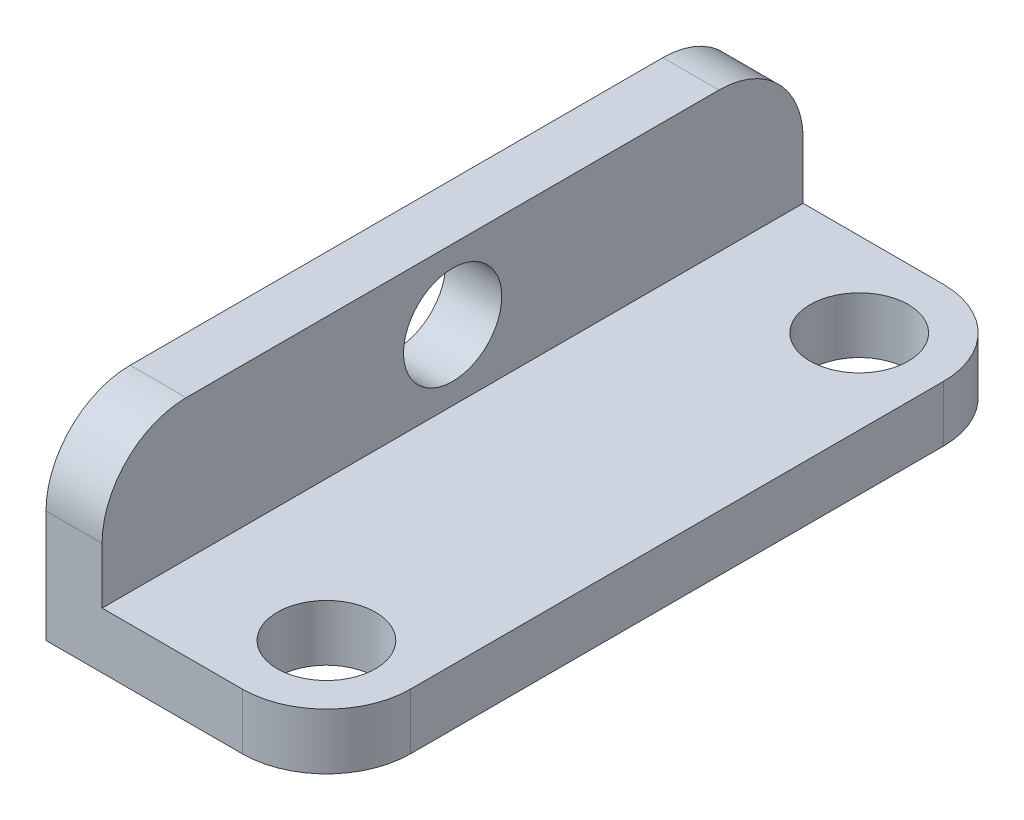
from build123d import *

# Parameters (mm, degrees)
BOSS_EXTRUDE1_DEPTH = 12.5
FILLET1_R           = 3
SKETCH2_R           = 1.75
CUT_EXTRUDE1_DEPTH  = 15.361406616
SKETCH3_R           = 1.75
CUT_EXTRUDE2_DEPTH  = 17.007810594


with BuildPart() as part:
    # Sketch1 → Boss-Extrude1 (new, symmetric)
    with BuildSketch(Plane.XY):
        Polygon((-3, 1), (5, 1), (5, -1), (-5, -1), (-5, 1), (-5, 6), (-3, 6), align=None)
    extrude(amount=BOSS_EXTRUDE1_DEPTH, both=True)

    # Fillet1
    fillet1_edges = [part.edges().sort_by_distance(p)[0] for p in [
        (5, 0, -12.5),
        (-4, 6, 12.5),
        (5, 0, 12.5),
        (-4, 6, -12.5),
    ]]
    fillet(fillet1_edges, radius=FILLET1_R)

    # Sketch2 → Cut-Extrude1 (cut, through all)
    with BuildSketch(Plane(origin=(0, 1, 0), x_dir=(1, 0, 0), z_dir=(0, 1, 0))):
        with Locations(Location((2, -9.5, 0), (0, 0, 270))):
            Circle(SKETCH2_R)
        with Locations(Location((2, 9.5, 0), (0, 0, 90))):
            Circle(SKETCH2_R)
    extrude(amount=-CUT_EXTRUDE1_DEPTH, mode=Mode.SUBTRACT)

    # Sketch3 → Cut-Extrude2 (cut, through all)
    with BuildSketch(Plane(origin=(-3, 0, 0), x_dir=(0, 0, -1), z_dir=(1, 0, 0))):
        with Locations((0, 3.5)):
            Circle(SKETCH3_R)
    extrude(amount=-CUT_EXTRUDE2_DEPTH, mode=Mode.SUBTRACT)


solid = part.part
